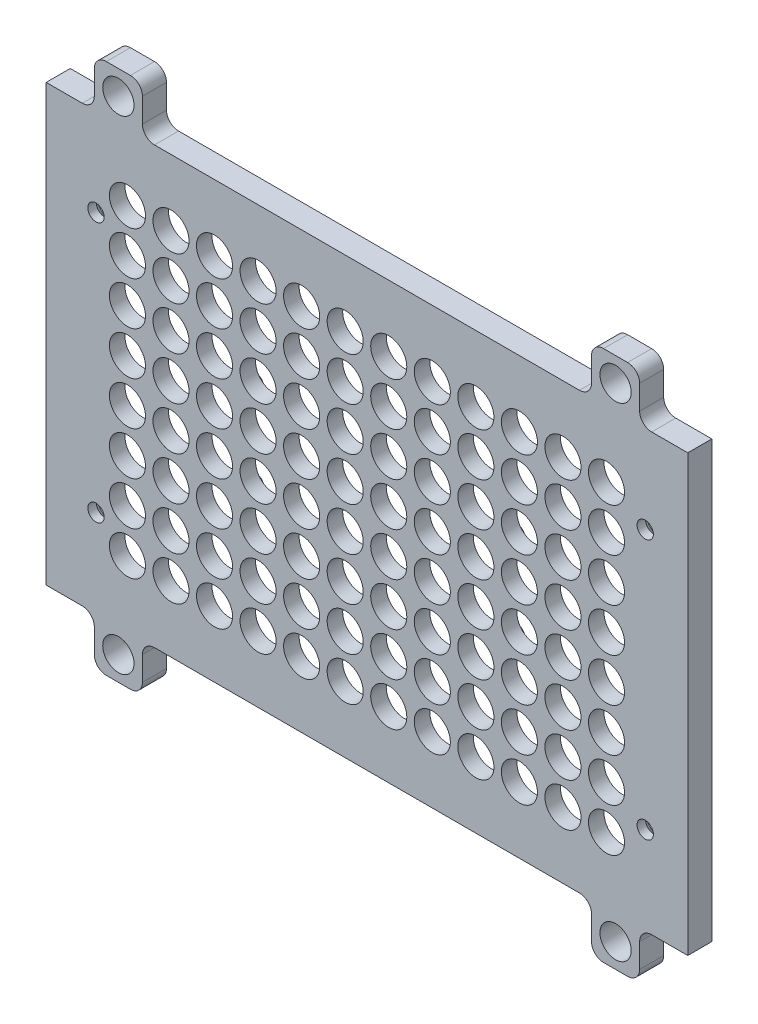
from build123d import *

# Parameters (mm, degrees)
SKETCH1_W                                       = 133.2946
SKETCH1_H                                       = 90.45
BOSS_EXTRUDE1_DEPTH                             = 5
SKETCH2_W                                       = 129.2946
SKETCH2_H                                       = 86.45
SKETCH2_W_2                                     = 121.5446
SKETCH2_H_2                                     = 78.75
CUT_EXTRUDE1_DEPTH                              = 4.5
SKETCH3_R                                       = 3.75
CUT_EXTRUDE5_DEPTH                              = 10
LPATTERN1_COUNT                                 = 8
LPATTERN1_PITCH                                 = 9
LPATTERN1_COUNT_DIR2                            = 12
LPATTERN1_PITCH_DIR2                            = 9.04818
SKETCH8_W                                       = 121.5446
SKETCH8_H                                       = 78.75
CUT_EXTRUDE8_DEPTH                              = 1.77
FILLET4_R                                       = 4.15
FILLET5_R                                       = 2.3
SKETCH10_R                                      = 0.95
CUT_EXTRUDE10_DEPTH                             = 10
SKETCH14_R                                      = 1.4
BOSS_EXTRUDE3_DEPTH                             = 1
SKETCH17_W                                      = 10
SKETCH17_H                                      = 10
BOSS_EXTRUDE4_DEPTH                             = 5
SKETCH18_R                                      = 3.25
CUT_EXTRUDE13_DEPTH                             = 5
FILLET6_R                                       = 2.5
SKETCH21_R                                      = 1
CUT_EXTRUDE15_DEPTH                             = 1
CSK_FOR_M3_FLAT_HEAD_MACHINE_SCREW1_D           = 3.4
CSK_FOR_M3_FLAT_HEAD_MACHINE_SCREW1_CSINK_D     = 6.3
CSK_FOR_M3_FLAT_HEAD_MACHINE_SCREW1_CSINK_ANGLE = 90


with BuildPart() as part:
    # Sketch1 → Boss-Extrude1 (new body)
    with BuildSketch(Plane.XY):
        with Locations((10.422357149, 27.785043963)):
            Rectangle(SKETCH1_W, SKETCH1_H)
    extrude(amount=BOSS_EXTRUDE1_DEPTH)

    # Sketch2 → Cut-Extrude1 (cut)
    with BuildSketch(Plane(origin=(0, 0, 0), x_dir=(-1, 0, 0), z_dir=(0, 0, -1))):
        with Locations((-10.422357149, 27.785043963)):
            Rectangle(SKETCH2_W, SKETCH2_H)
        with Locations((-10.422357149, 27.785043963)):
            Rectangle(SKETCH2_W_2, SKETCH2_H_2, mode=Mode.SUBTRACT)
    extrude(amount=-CUT_EXTRUDE1_DEPTH, mode=Mode.SUBTRACT)

    # Sketch3 → Cut-Extrude5 (cut)
    with BuildSketch(Plane(origin=(0, 0, 0), x_dir=(-1, 0, 0), z_dir=(0, 0, -1))):
        with Locations((39.342632851, -3.714956037)):
            Circle(SKETCH3_R)
    cut_extrude5 = extrude(amount=-CUT_EXTRUDE5_DEPTH, mode=Mode.SUBTRACT)

    # LPattern1: Cut-Extrude5 8 × 12
    with Locations(*[(j * LPATTERN1_PITCH_DIR2, i * LPATTERN1_PITCH, 0) for i in range(LPATTERN1_COUNT) for j in range(LPATTERN1_COUNT_DIR2) if (i, j) != (0, 0)]):
        add(cut_extrude5, mode=Mode.SUBTRACT)

    # Sketch8 → Cut-Extrude8 (cut)
    with BuildSketch(Plane(origin=(0, 0, 0), x_dir=(-1, 0, 0), z_dir=(0, 0, -1))):
        with Locations((-10.422357149, 27.785043963)):
            Rectangle(SKETCH8_W, SKETCH8_H)
    extrude(amount=-CUT_EXTRUDE8_DEPTH, mode=Mode.SUBTRACT)

    # Fillet4
    fillet4_edges = [part.edges().sort_by_distance(p)[0] for p in [
        (-54.224942851, 71.010043963, 2.25),
        (-54.224942851, -15.439956037, 2.25),
        (75.069657149, -15.439956037, 2.25),
        (75.069657149, 71.010043963, 2.25),
    ]]
    fillet(fillet4_edges, radius=FILLET4_R)

    # Fillet5
    fillet5_edges = [part.edges().sort_by_distance(p)[0] for p in [
        (-50.349942851, -11.589956037, 3.135),
        (71.194657149, -11.589956037, 3.135),
        (71.194657149, 67.160043963, 3.135),
        (-50.349942851, 67.160043963, 3.135),
    ]]
    fillet(fillet5_edges, radius=FILLET5_R)

    # Sketch10 → Cut-Extrude10 (cut)
    with BuildSketch(Plane.XY.offset(5)):
        with Locations((68.230147149, 54.780043963)):
            Circle(SKETCH10_R)
        with Locations((68.230147149, 0.790043963)):
            Circle(SKETCH10_R)
        with Locations((-45.877428851, 0.790043963)):
            Circle(SKETCH10_R)
        with Locations((-45.877428851, 54.780043963)):
            Circle(SKETCH10_R)
    extrude(amount=-CUT_EXTRUDE10_DEPTH, mode=Mode.SUBTRACT)

    # Sketch14 → Boss-Extrude3 (add)
    with BuildSketch(Plane(origin=(0, 0, 1.77), x_dir=(-1, 0, 0), z_dir=(0, 0, -1))):
        with Locations((-37.566897149, 36.785043963)):
            Circle(SKETCH14_R)
        with Locations((-37.566897149, 18.785043963)):
            Circle(SKETCH14_R)
        with Locations((16.722182851, 36.785043963)):
            Circle(SKETCH14_R)
        with Locations((16.722182851, 18.785043963)):
            Circle(SKETCH14_R)
    extrude(amount=BOSS_EXTRUDE3_DEPTH)

    # Sketch17 → Boss-Extrude4 (add)
    with BuildSketch(Plane(origin=(0, 0, 0), x_dir=(-1, 0, 0), z_dir=(0, 0, -1))):
        with Locations((-62.069657149, -22.439956037)):
            Rectangle(SKETCH17_W, SKETCH17_H)
        with Locations((-62.069657149, 78.010043963)):
            Rectangle(SKETCH17_W, SKETCH17_H)
        with Locations((41.224942851, -22.439956037)):
            Rectangle(SKETCH17_W, SKETCH17_H)
        with Locations((41.224942851, 78.010043963)):
            Rectangle(SKETCH17_W, SKETCH17_H)
    extrude(amount=-BOSS_EXTRUDE4_DEPTH)

    # Sketch18 → Cut-Extrude13 (cut)
    with BuildSketch(Plane(origin=(0, 0, 0), x_dir=(-1, 0, 0), z_dir=(0, 0, -1))):
        with Locations((-62.069657149, -22.439956037)):
            Circle(SKETCH18_R)
        with Locations((-62.069657149, 78.010043963)):
            Circle(SKETCH18_R)
        with Locations((41.224942851, 78.010043963)):
            Circle(SKETCH18_R)
        with Locations((41.224942851, -22.439956037)):
            Circle(SKETCH18_R)
    extrude(amount=-CUT_EXTRUDE13_DEPTH, mode=Mode.SUBTRACT)

    # Fillet6
    fillet6_edges = [part.edges().sort_by_distance(p)[0] for p in [
        (67.069657149, -17.439956037, 2.5),
        (57.069657149, -17.439956037, 2.5),
        (-36.224942851, -17.439956037, 2.5),
        (-46.224942851, -17.439956037, 2.5),
        (67.069657149, 73.010043963, 2.5),
        (57.069657149, 73.010043963, 2.5),
        (-36.224942851, 73.010043963, 2.5),
        (-46.224942851, 73.010043963, 2.5),
        (67.069657149, 83.010043963, 2.5),
        (57.069657149, 83.010043963, 2.5),
        (-36.224942851, 83.010043963, 2.5),
        (-46.224942851, 83.010043963, 2.5),
        (67.069657149, -27.439956037, 2.5),
        (57.069657149, -27.439956037, 2.5),
        (-36.224942851, -27.439956037, 2.5),
        (-46.224942851, -27.439956037, 2.5),
    ]]
    fillet(fillet6_edges, radius=FILLET6_R)

    # Sketch21 → Cut-Extrude15 (cut)
    with BuildSketch(Plane(origin=(0, 0, 0), x_dir=(-1, 0, 0), z_dir=(0, 0, -1))):
        with Locations((-75.46190372, -15.832202608)):
            Circle(SKETCH21_R)
    extrude(amount=-CUT_EXTRUDE15_DEPTH, mode=Mode.SUBTRACT)

    # CSK for M3 Flat Head Machine Screw1 (through all)
    with Locations(Plane(origin=(0, 0, 1.77), x_dir=(-1, 0, 0), z_dir=(0, 0, -1))):
        with Locations((45.877428851, 0.790043963), (45.877428851, 54.780043963), (-68.230147149, 54.780043963), (-68.230147149, 0.790043963)):
            CounterSinkHole(CSK_FOR_M3_FLAT_HEAD_MACHINE_SCREW1_D / 2, CSK_FOR_M3_FLAT_HEAD_MACHINE_SCREW1_CSINK_D / 2, counter_sink_angle=CSK_FOR_M3_FLAT_HEAD_MACHINE_SCREW1_CSINK_ANGLE)


solid = part.part
